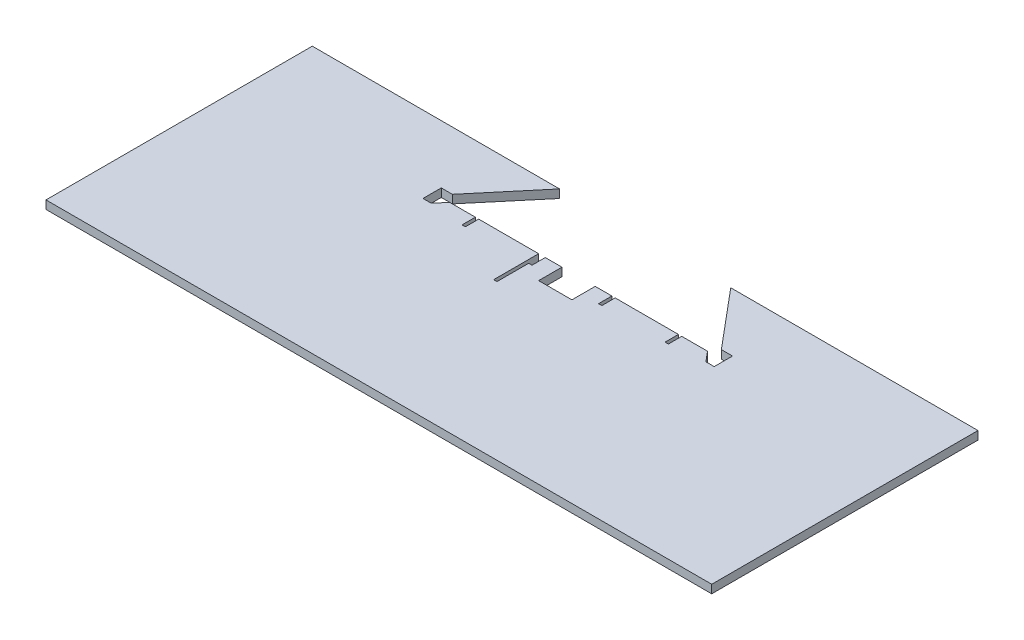
from build123d import *

# Parameters (mm, degrees)
BOSS_EXTRUDE1_DEPTH = 3.175
SKETCH2_W           = 1.27
SKETCH2_H           = 5.08
SKETCH2_W_2         = 12.7
SKETCH2_H_2         = 8.89
CUT_EXTRUDE1_DEPTH  = 3.175


with BuildPart() as part:
    # Sketch1 → Boss-Extrude1 (new body)
    with BuildSketch(Plane(origin=(0, 0, 0), x_dir=(1, 0, 0), z_dir=(0, 1, 0))):
        Polygon((32.661869368, 101.6), (127, 101.6), (127, 0), (-127, 0), (-127, 101.6), (-32.661869368, 101.6), (-53.975, 76.2), (53.975, 76.2), align=None)
    extrude(amount=BOSS_EXTRUDE1_DEPTH)

    # Sketch2 → Cut-Extrude1 (cut)
    with BuildSketch(Plane(origin=(0, 3.175, 0), x_dir=(-1, 0, 0), z_dir=(0, 1, 0))):
        with Locations((38.735, -73.66)):
            Rectangle(SKETCH2_W, SKETCH2_H)
        Polygon((52.3875, -72.39), (49.190530405, -76.2), (53.975, -76.2), (51.310858671, -79.375), (55.5625, -79.375), (55.5625, -72.39), align=None)
        Polygon((12.7, -76.2), (15.24, -76.2), (15.24, -59.055), (13.97, -59.055), (13.97, -71.12), (12.7, -71.12), align=None)
        with Locations((0, -71.755)):
            Rectangle(SKETCH2_W_2, SKETCH2_H_2)
        with Locations((-13.335, -73.66)):
            Rectangle(SKETCH2_W, SKETCH2_H)
        with Locations((-38.735, -73.66)):
            Rectangle(SKETCH2_W, SKETCH2_H)
        Polygon((-53.975, -76.2), (-49.190530405, -76.2), (-52.3875, -72.39), (-55.5625, -72.39), (-55.5625, -79.375), (-51.310858671, -79.375), align=None)
    extrude(amount=-CUT_EXTRUDE1_DEPTH, mode=Mode.SUBTRACT)


solid = part.part
